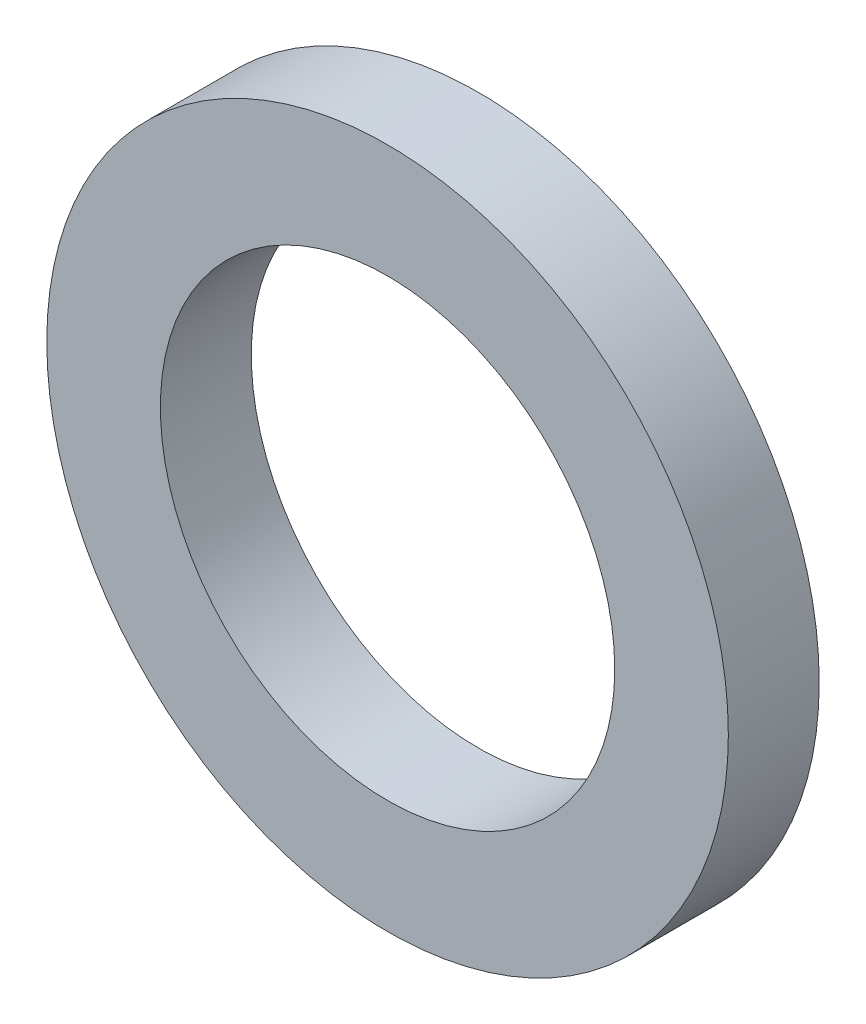
from build123d import *

# Parameters (mm, degrees)
SKETCH_1_R      = 7.5
SKETCH_1_R_2    = 5
EXTRUDE_1_DEPTH = 2


with BuildPart() as part:
    # 草图1 → 凸台-拉伸1 (new body)
    with BuildSketch(Plane.XY):
        Circle(SKETCH_1_R)
        Circle(SKETCH_1_R_2, mode=Mode.SUBTRACT)
    extrude(amount=EXTRUDE_1_DEPTH)


solid = part.part
